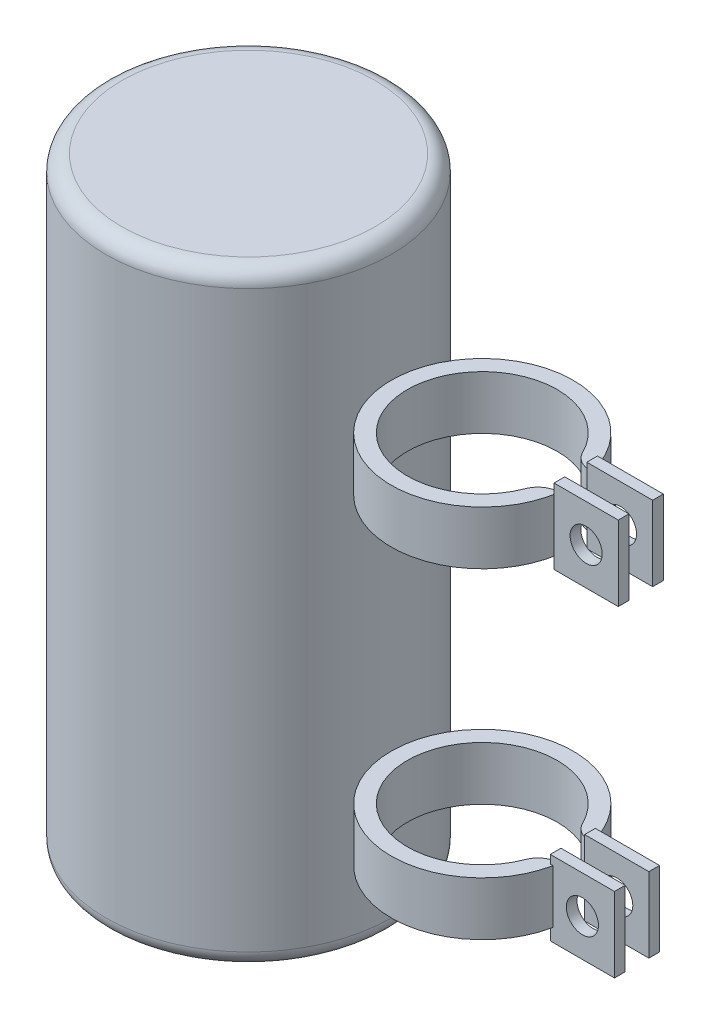
from build123d import *

# Parameters (mm, degrees)
SKETCH1_R               = 13.33333325
BOSS_EXTRUDE1_DEPTH     = 56.666666667
SHELL1_T                = 1.5
BOSS_EXTRUDE2_START     = 25
BOSS_EXTRUDE2_DEPTH     = 0.75
FILLET1_R               = 1.5
BOSS_EXTRUDE3_START     = 40
BOSS_EXTRUDE3_DEPTH     = 5
BOSS_EXTRUDE4_START     = 10
BOSS_EXTRUDE4_DEPTH     = 5
SKETCH6_W               = 7
SKETCH6_H               = 6
BOSS_EXTRUDE5_DEPTH     = 0.5
SKETCH7_W               = 7
SKETCH7_H               = 6.152035158
BOSS_EXTRUDE6_DEPTH     = 0.5
CUT_EXTRUDE1_DEPTH      = 69.821898483
CUT_EXTRUDE1_DEPTH_BACK = 69.821898483
SKETCH10_R              = 1.5
CUT_EXTRUDE3_START      = 24.25
SKETCH14_R              = 2.5
CUT_EXTRUDE3_DEPTH      = 92.592140625
SKETCH17_W              = 7
SKETCH17_H              = 6
BOSS_EXTRUDE7_DEPTH     = 0.5
SKETCH18_W              = 7
SKETCH18_H              = 6
BOSS_EXTRUDE8_DEPTH     = 0.5
CUT_EXTRUDE4_DEPTH      = 69.92929243
CUT_EXTRUDE4_DEPTH_BACK = 69.92929243
SKETCH19_R              = 1.5


with BuildPart() as part:
    # Sketch1 → Boss-Extrude1 (new body)
    with BuildSketch(Plane(origin=(0, 0, 0), x_dir=(1, 0, 0), z_dir=(0, 1, 0))):
        with Locations(Location((0, 0, 0), (0, 0, 270))):
            Circle(SKETCH1_R)
    extrude(amount=BOSS_EXTRUDE1_DEPTH)

    # Shell1 (no face opened: a closed hollow body)
    add(offset(amount=-SHELL1_T, mode=Mode.PRIVATE), mode=Mode.SUBTRACT)

    # Sketch4 → Boss-Extrude2 (add, symmetric)
    with BuildSketch(Plane(origin=(0, 1.5, 0), x_dir=(1, 0, 0), z_dir=(0, 1, 0)).offset(BOSS_EXTRUDE2_START)):
        with BuildLine():
            Line((-8.24417487, -8.488896072), (8.24417487, -8.488896072))
            ThreePointArc((8.24417487, -8.488896072), (0, 11.83333325), (-8.24417487, -8.488896072))
        make_face()
    extrude(amount=BOSS_EXTRUDE2_DEPTH, both=True)

    # Fillet1
    fillet1_edges = [part.edges().sort_by_distance(p)[0] for p in [
        (0, 25.75, -11.83333325),
        (0, 27.25, -11.83333325),
        (0, 0, -13.33333325),
        (0, 56.666666667, -13.33333325),
        (0, 1.5, -11.83333325),
        (0, 55.166666667, -11.83333325),
    ]]
    fillet(fillet1_edges, radius=FILLET1_R)

    # Sketch14 → Cut-Extrude3 (cut, through all)
    with BuildSketch(Plane(origin=(0, 1.5, 0), x_dir=(1, 0, 0), z_dir=(0, 1, 0)).offset(CUT_EXTRUDE3_START)):
        with Locations(Location((0, -9.122154062, 0), (0, 0, 270))):
            Circle(SKETCH14_R)
    extrude(amount=-CUT_EXTRUDE3_DEPTH, mode=Mode.SUBTRACT)


with BuildPart() as body_2:
    # Sketch5 → Boss-Extrude3 (new body)
    with BuildSketch(Plane(origin=(0, 0, 0), x_dir=(1, 0, 0), z_dir=(0, 1, 0)).offset(BOSS_EXTRUDE3_START)):
        with BuildLine():
            ThreePointArc((30.094689071, 2), (13.34284922, -0.402095671), (30.246724229, -1.210310804))
            ThreePointArc((30.246724229, -1.210310804), (29.109252858, -1.561527255), (28.372865111, -2.496902688))
            ThreePointArc((28.372865111, -2.496902688), (14.841169931, -0.331137612), (28.107627448, 3.103744886))
            ThreePointArc((28.107627448, 3.103744886), (28.929116914, 2.242148013), (30.094689071, 2))
        make_face()
    extrude(amount=BOSS_EXTRUDE3_DEPTH)


with BuildPart() as body_3:
    # Sketch5<3> → Boss-Extrude4 (new body)
    with BuildSketch(Plane(origin=(0, 0, 0), x_dir=(1, 0, 0), z_dir=(0, 1, 0)).offset(BOSS_EXTRUDE4_START)):
        with BuildLine():
            ThreePointArc((30.094689071, 2), (13.34284922, -0.402095671), (30.246724229, -1.210310804))
            ThreePointArc((30.246724229, -1.210310804), (29.109252858, -1.561527255), (28.372865111, -2.496902688))
            ThreePointArc((28.372865111, -2.496902688), (14.841169931, -0.331137612), (28.107627448, 3.103744886))
            ThreePointArc((28.107627448, 3.103744886), (28.929116914, 2.242148013), (30.094689071, 2))
        make_face()
    extrude(amount=BOSS_EXTRUDE4_DEPTH)

    # Sketch17 → Boss-Extrude7 (add, symmetric)
    with BuildSketch(Plane(origin=(0, 0, 1.210310804), x_dir=(0, -1, 0), z_dir=(0, 0, 1))):
        with Locations((-12.27876271, 32.89436936)):
            Rectangle(SKETCH17_W, SKETCH17_H)
    extrude(amount=BOSS_EXTRUDE7_DEPTH, both=True)

    # Sketch18 → Boss-Extrude8 (add, symmetric)
    with BuildSketch(Plane(origin=(0, 0, -2), x_dir=(0, -1, 0), z_dir=(0, 0, 1))):
        with Locations((-12.27876271, 32.89436936)):
            Rectangle(SKETCH18_W, SKETCH18_H)
    extrude(amount=BOSS_EXTRUDE8_DEPTH, both=True)

    # Sketch19 → Cut-Extrude4 (cut, two sides: drawn at the far end of the back side and taken through both)
    with BuildSketch(Plane.XY.offset(1.710310804).offset(-CUT_EXTRUDE4_DEPTH_BACK)):
        with Locations((32.89436936, 12.27876271)):
            Circle(SKETCH19_R)
    extrude(amount=CUT_EXTRUDE4_DEPTH + CUT_EXTRUDE4_DEPTH_BACK, mode=Mode.SUBTRACT)


with BuildPart() as body_4:
    # Sketch6 → Boss-Extrude5 (new, symmetric)
    with BuildSketch(Plane(origin=(0, 0, 1.210310804), x_dir=(0, -1, 0), z_dir=(0, 0, 1))):
        with Locations((-42.5, 33.246724229)):
            Rectangle(SKETCH6_W, SKETCH6_H)
    extrude(amount=BOSS_EXTRUDE5_DEPTH, both=True)


with BuildPart() as body_5:
    # Sketch7 → Boss-Extrude6 (new, symmetric)
    with BuildSketch(Plane(origin=(0, 0, -2), x_dir=(0, -1, 0), z_dir=(0, 0, 1))):
        with Locations((-42.5, 33.17070665)):
            Rectangle(SKETCH7_W, SKETCH7_H)
    extrude(amount=BOSS_EXTRUDE6_DEPTH, both=True)


with BuildPart() as cut_extrude1_tool:
    # Sketch10 → Cut-Extrude1 (new, two sides: drawn at the far end of the back side and taken through both)
    with BuildSketch(Plane(origin=(0, 0, 1.210310804), x_dir=(0, -1, 0), z_dir=(0, 0, 1)).offset(-CUT_EXTRUDE1_DEPTH_BACK)):
        with Locations(Location((-42.5, 33.246724229, 0), (0, 0, 90))):
            Circle(SKETCH10_R)
    extrude(amount=CUT_EXTRUDE1_DEPTH + CUT_EXTRUDE1_DEPTH_BACK)


with BuildPart() as body_4_1:
    add(body_4.part)

    # Cut-Extrude1: cut by cut_extrude1_tool
    add(cut_extrude1_tool.part, mode=Mode.SUBTRACT)


with BuildPart() as body_5_1:
    add(body_5.part)

    # Cut-Extrude1: cut by cut_extrude1_tool
    add(cut_extrude1_tool.part, mode=Mode.SUBTRACT)


solid = Compound([part.part, body_2.part, body_3.part, body_4_1.part, body_5_1.part])
